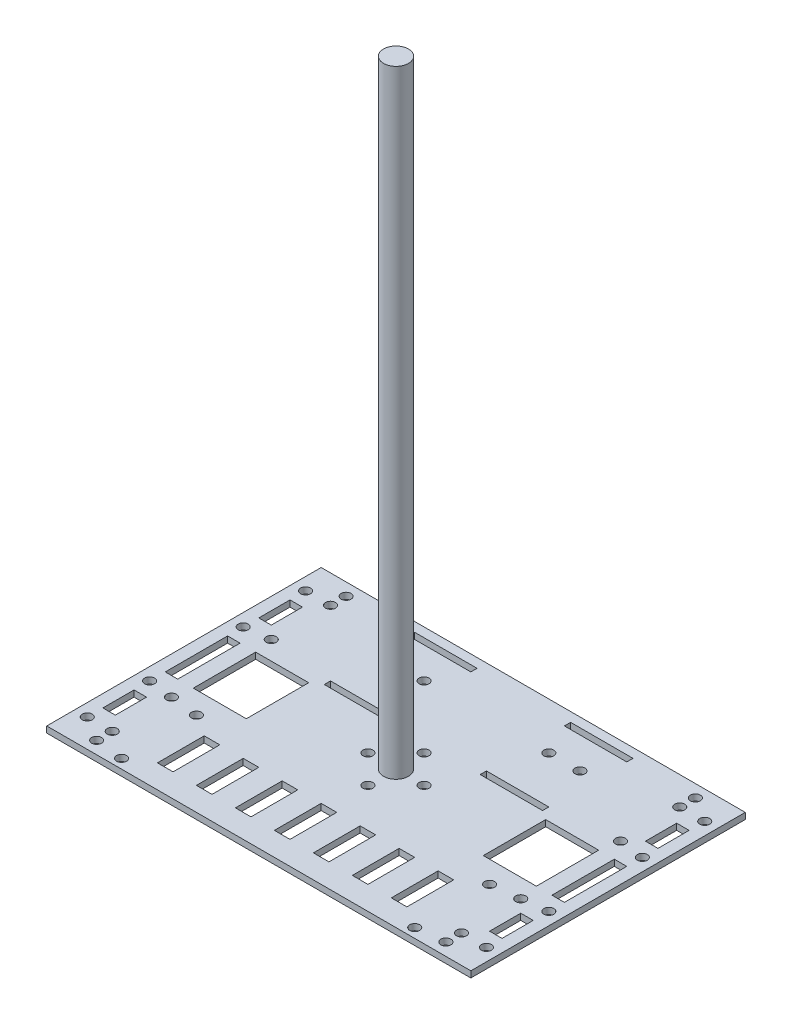
from build123d import *

# Parameters (mm, degrees)
SKETCH_1_W          = 136
SKETCH_1_H          = 88
EXTRUDE_1_DEPTH     = 2
SKETCH_2_R          = 1.6
SKETCH_2_W          = 4
SKETCH_2_H          = 10
SKETCH_2_H_2        = 20
CUT_EXTRUDE_1_DEPTH = 2
SKETCH_5_R          = 1.6
CUT_EXTRUDE_2_DEPTH = 10
SKETCH_6_R          = 1.6
CUT_EXTRUDE_3_DEPTH = 10
SKETCH_10_R         = 1.6
CUT_EXTRUDE_4_DEPTH = 10
SKETCH_11_R         = 4
EXTRUDE_3_DEPTH     = 200
SKETCH_13_W         = 20
SKETCH_13_H         = 2
CUT_EXTRUDE_5_DEPTH = 2
CUT_EXTRUDE_6_DEPTH = 10
SKETCH_15_W         = 5
SKETCH_15_H         = 15
CUT_EXTRUDE_7_DEPTH = 5
SKETCH_16_R         = 1.6
CUT_EXTRUDE_8_DEPTH = 10


with BuildPart() as part:
    # 草图1 → 凸台-拉伸1 (new body)
    with BuildSketch(Plane(origin=(0, 0, 0), x_dir=(1, 0, 0), z_dir=(0, 1, 0))):
        with Locations((68, -44)):
            Rectangle(SKETCH_1_W, SKETCH_1_H)
    extrude(amount=EXTRUDE_1_DEPTH)

    # 草图2 → 切除-拉伸1 (cut)
    with BuildSketch(Plane(origin=(0, 2, 0), x_dir=(1, 0, 0), z_dir=(0, 1, 0))):
        with Locations(Location((4, -29, 0), (0, 0, 270))):
            Circle(SKETCH_2_R)
        with Locations(Location((4, -9, 0), (0, 0, 270))):
            Circle(SKETCH_2_R)
        with Locations(Location((132, -9, 0), (0, 0, 90))):
            Circle(SKETCH_2_R)
        with Locations(Location((132, -29, 0), (0, 0, 90))):
            Circle(SKETCH_2_R)
        with Locations(Location((132, -59, 0), (0, 0, 270))):
            Circle(SKETCH_2_R)
        with Locations(Location((132, -79, 0), (0, 0, 270))):
            Circle(SKETCH_2_R)
        with Locations(Location((4, -79, 0), (0, 0, 90))):
            Circle(SKETCH_2_R)
        with Locations(Location((4, -59, 0), (0, 0, 90))):
            Circle(SKETCH_2_R)
        Polygon((4, -44), (4, -34), (8, -34), (8, -44), (8, -54), (4, -54), align=None)
        with Locations((6, -19)):
            Rectangle(SKETCH_2_W, SKETCH_2_H)
        with Locations((130, -19)):
            Rectangle(SKETCH_2_W, SKETCH_2_H)
        with Locations((130, -44)):
            Rectangle(SKETCH_2_W, SKETCH_2_H_2)
        with Locations((130, -69)):
            Rectangle(SKETCH_2_W, SKETCH_2_H)
        with Locations((6, -69)):
            Rectangle(SKETCH_2_W, SKETCH_2_H)
    extrude(amount=-CUT_EXTRUDE_1_DEPTH, mode=Mode.SUBTRACT)

    # 草图5 → 切除-拉伸2 (cut)
    with BuildSketch(Plane(origin=(0, 2, 0), x_dir=(1, 0, 0), z_dir=(0, 1, 0))):
        with Locations(Location((12, -28, 0), (0, 0, 270))):
            Circle(SKETCH_5_R)
        with Locations(Location((12, -60, 0), (0, 0, 270))):
            Circle(SKETCH_5_R)
        with Locations(Location((124, -60, 0), (0, 0, 270))):
            Circle(SKETCH_5_R)
        with Locations(Location((124, -28, 0), (0, 0, 270))):
            Circle(SKETCH_5_R)
        with Locations(Location((12, -79, 0), (0, 0, 270))):
            Circle(SKETCH_5_R)
        with Locations(Location((12, -84, 0), (0, 0, 270))):
            Circle(SKETCH_5_R)
        with Locations(Location((12, -9, 0), (0, 0, 270))):
            Circle(SKETCH_5_R)
        with Locations(Location((12, -4, 0), (0, 0, 270))):
            Circle(SKETCH_5_R)
        with Locations(Location((124, -84, 0), (0, 0, 270))):
            Circle(SKETCH_5_R)
        with Locations(Location((124, -79, 0), (0, 0, 270))):
            Circle(SKETCH_5_R)
        with Locations(Location((124, -4, 0), (0, 0, 270))):
            Circle(SKETCH_5_R)
        with Locations(Location((124, -9, 0), (0, 0, 270))):
            Circle(SKETCH_5_R)
    extrude(amount=-CUT_EXTRUDE_2_DEPTH, mode=Mode.SUBTRACT)

    # 草图6 → 切除-拉伸3 (cut)
    with BuildSketch(Plane(origin=(0, 2, 0), x_dir=(1, 0, 0), z_dir=(0, 1, 0))):
        with Locations(Location((68, -35, 0), (0, 0, 270))):
            Circle(SKETCH_6_R)
        with Locations(Location((68, -53, 0), (0, 0, 270))):
            Circle(SKETCH_6_R)
        with Locations(Location((77, -44, 0), (0, 0, 270))):
            Circle(SKETCH_6_R)
        with Locations(Location((59, -44, 0), (0, 0, 270))):
            Circle(SKETCH_6_R)
    extrude(amount=-CUT_EXTRUDE_3_DEPTH, mode=Mode.SUBTRACT)

    # 草图10 → 切除-拉伸4 (cut)
    with BuildSketch(Plane(origin=(0, 2, 0), x_dir=(1, 0, 0), z_dir=(0, 1, 0))):
        with Locations(Location((21, -85, 0), (0, 0, 270))):
            Circle(SKETCH_10_R)
        with Locations(Location((21, -61, 0), (0, 0, 270))):
            Circle(SKETCH_10_R)
        with Locations(Location((115, -61, 0), (0, 0, 270))):
            Circle(SKETCH_10_R)
        with Locations(Location((115, -85, 0), (0, 0, 270))):
            Circle(SKETCH_10_R)
    extrude(amount=-CUT_EXTRUDE_4_DEPTH, mode=Mode.SUBTRACT)

    # 草图11 → 凸台-拉伸3 (add)
    with BuildSketch(Plane.XZ):
        with Locations(Location((68, 44, 0), (0, 0, 270))):
            Circle(SKETCH_11_R)
    extrude(amount=-EXTRUDE_3_DEPTH)

    # 草图13 → 切除-拉伸5 (cut)
    with BuildSketch(Plane(origin=(0, 2, 0), x_dir=(1, 0, 0), z_dir=(0, 1, 0))):
        with Locations((43, -4)):
            Rectangle(SKETCH_13_W, SKETCH_13_H)
        with Locations((43, -31)):
            Rectangle(SKETCH_13_W, SKETCH_13_H)
        with Locations((93, -31)):
            Rectangle(SKETCH_13_W, SKETCH_13_H)
        with Locations((93, -4)):
            Rectangle(SKETCH_13_W, SKETCH_13_H)
    extrude(amount=-CUT_EXTRUDE_5_DEPTH, mode=Mode.SUBTRACT)

    # 草图14 → 切除-拉伸6 (cut)
    with BuildSketch(Plane(origin=(0, 2, 0), x_dir=(1, 0, 0), z_dir=(0, 1, 0))):
        Polygon((13, -44), (13, -34), (30, -34), (30, -54), (13, -54), align=None)
        Polygon((106, -34), (106, -54), (123, -54), (123, -44), (123, -34), align=None)
    extrude(amount=-CUT_EXTRUDE_6_DEPTH, mode=Mode.SUBTRACT)

    # 草图15 → 切除-拉伸7 (cut)
    with BuildSketch(Plane(origin=(0, 2, 0), x_dir=(1, 0, 0), z_dir=(0, 1, 0))):
        with Locations((68, -73)):
            Rectangle(SKETCH_15_W, SKETCH_15_H)
        with Locations((80.5, -73)):
            Rectangle(SKETCH_15_W, SKETCH_15_H)
        with Locations((93, -73)):
            Rectangle(SKETCH_15_W, SKETCH_15_H)
        with Locations((105.5, -73)):
            Rectangle(SKETCH_15_W, SKETCH_15_H)
        with Locations((55.5, -73)):
            Rectangle(SKETCH_15_W, SKETCH_15_H)
        with Locations((43, -73)):
            Rectangle(SKETCH_15_W, SKETCH_15_H)
        with Locations((30.5, -73)):
            Rectangle(SKETCH_15_W, SKETCH_15_H)
    extrude(amount=-CUT_EXTRUDE_7_DEPTH, mode=Mode.SUBTRACT)

    # 草图16 → 切除-拉伸8 (cut)
    with BuildSketch(Plane.XZ):
        with Locations(Location((88, 15, 0), (0, 0, 270))):
            Circle(SKETCH_16_R)
        with Locations(Location((48, 15, 0), (0, 0, 270))):
            Circle(SKETCH_16_R)
        with Locations(Location((98, 15, 0), (0, 0, 270))):
            Circle(SKETCH_16_R)
        with Locations(Location((38, 15, 0), (0, 0, 270))):
            Circle(SKETCH_16_R)
    extrude(amount=-CUT_EXTRUDE_8_DEPTH, mode=Mode.SUBTRACT)


solid = part.part
